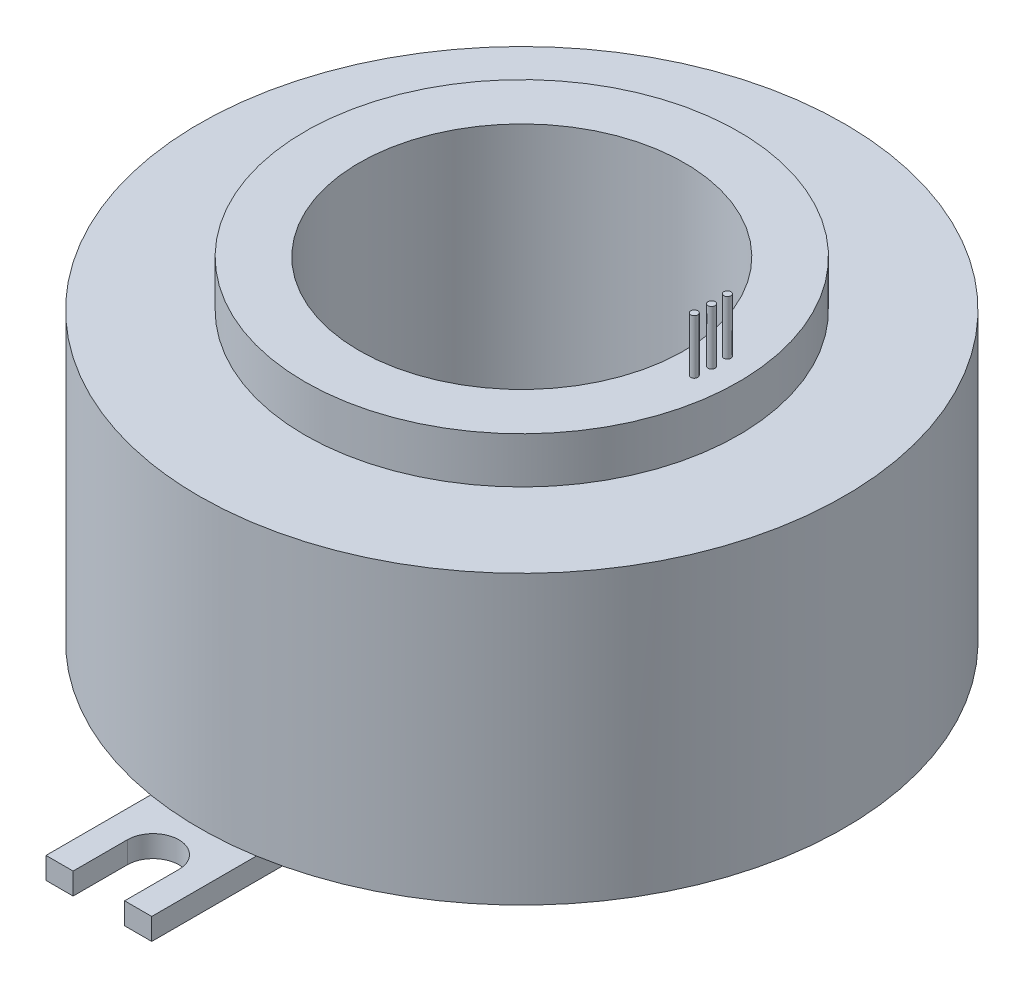
from build123d import *

# Parameters (mm, degrees)
CROQUIS1_R              = 59.5
SALIENTE_EXTRUIR1_DEPTH = 53
CROQUIS2_R              = 40
SALIENTE_EXTRUIR2_DEPTH = 8.5
CORTAR_EXTRUIR1_REACH   = 106.225
CROQUIS4_R              = 30
CROQUIS5_R              = 0.65
SALIENTE_EXTRUIR3_DEPTH = 10
CROQUIS6_R              = 0.65
SALIENTE_EXTRUIR4_DEPTH = 10
SALIENTE_EXTRUIR5_DEPTH = 4


with BuildPart() as part:
    # Croquis1 → Saliente-Extruir1 (new body)
    with BuildSketch(Plane(origin=(0, 0, 0), x_dir=(1, 0, 0), z_dir=(0, 1, 0))):
        with Locations(Location((0, 0, 0), (0, 0, 270))):
            Circle(CROQUIS1_R)
    extrude(amount=SALIENTE_EXTRUIR1_DEPTH)

    # Croquis2 → Saliente-Extruir2 (add)
    with BuildSketch(Plane(origin=(0, 53, 0), x_dir=(1, 0, 0), z_dir=(0, 1, 0))):
        with Locations(Location((0, 0, 0), (0, 0, 270))):
            Circle(CROQUIS2_R)
    extrude(amount=SALIENTE_EXTRUIR2_DEPTH)

    # Croquis4 → Cortar-Extruir1 (cut, up to next)
    with BuildSketch(Plane(origin=(0, 61.5, 0), x_dir=(1, 0, 0), z_dir=(0, 1, 0)), mode=Mode.PRIVATE) as cortar_extruir1_sk1:
        with Locations(Location((0, 0, 0), (0, 0, 270))):
            Circle(CROQUIS4_R)
    cortar_extruir1_tool1 = extrude(cortar_extruir1_sk1.sketch, amount=-CORTAR_EXTRUIR1_REACH, mode=Mode.PRIVATE) & part.part
    add(cortar_extruir1_tool1.solids().sort_by_distance((0, 61.5, 0))[0], mode=Mode.SUBTRACT)

    # Croquis5 → Saliente-Extruir3 (add)
    with BuildSketch(Plane(origin=(0, 61.5, 0), x_dir=(1, 0, 0), z_dir=(0, 1, 0))):
        with Locations(Location((35, 0, 0), (0, 0, 270))):
            Circle(CROQUIS5_R)
        with Locations(Location((34.866814433, 3.050450996, 0), (0, 0, 270))):
            Circle(CROQUIS5_R)
        with Locations(Location((34.866814433, -3.050450996, 0), (0, 0, 90))):
            Circle(CROQUIS5_R)
    extrude(amount=SALIENTE_EXTRUIR3_DEPTH)

    # Croquis6 → Saliente-Extruir4 (add)
    with BuildSketch(Plane.XZ):
        with Locations(Location((45, 0, 0), (0, 0, 90))):
            Circle(CROQUIS6_R)
        with Locations(Location((44.828761414, 3.922008424, 0), (0, 0, 90))):
            Circle(CROQUIS6_R)
        with Locations(Location((44.828761414, -3.922008424, 0), (0, 0, 90))):
            Circle(CROQUIS6_R)
    extrude(amount=SALIENTE_EXTRUIR4_DEPTH)

    # Croquis10 → Saliente-Extruir5 (add)
    with BuildSketch(Plane.XZ):
        with BuildLine():
            ThreePointArc((4.75, 68), (0, 63.25), (-4.75, 68))
            Line((-4.75, 68), (-4.75, 78))
            Line((-4.75, 78), (-9.75, 78))
            Line((-9.75, 78), (-9.75, 48))
            Line((-9.75, 48), (9.75, 48))
            Line((9.75, 48), (9.75, 78))
            Line((9.75, 78), (4.75, 78))
            Line((4.75, 78), (4.75, 68))
        make_face()
    extrude(amount=SALIENTE_EXTRUIR5_DEPTH)


solid = part.part
